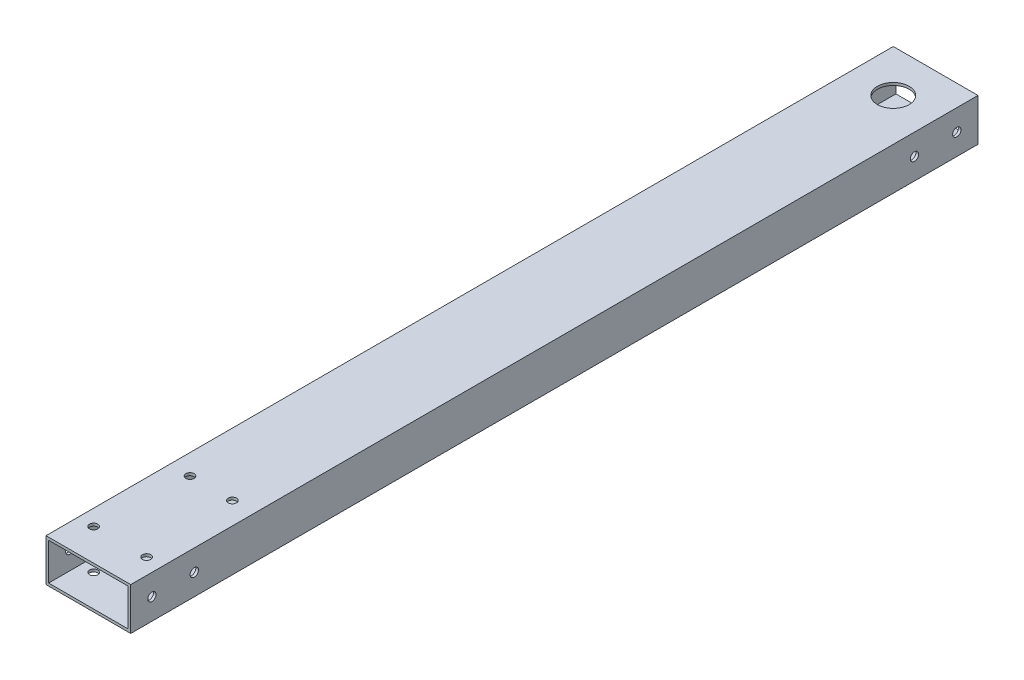
from build123d import *

# Parameters (mm, degrees)
BOSS_EXTRUDE1_DEPTH      = 254.000001
BOSS_EXTRUDE1_DEPTH_BACK = 254.000001
SKETCH3_W                = 50.8
SKETCH3_H                = 25.4
SKETCH3_W_2              = 47.625
SKETCH3_H_2              = 22.225
F_10_CLEARANCE_HOLE1_D   = 4.9784
F_10_CLEARANCE_HOLE2_D   = 4.9784
SKETCH11_R               = 9.525
CUT_EXTRUDE1_DEPTH       = 257.527426425


with BuildPart() as part:
    # Sketch3 → Boss-Extrude1 (new, two sides: drawn at the far end of the back side and taken through both)
    with BuildSketch(Plane.XY.offset(-BOSS_EXTRUDE1_DEPTH_BACK)):
        Rectangle(SKETCH3_W, SKETCH3_H)
        Rectangle(SKETCH3_W_2, SKETCH3_H_2, mode=Mode.SUBTRACT)
    extrude(amount=BOSS_EXTRUDE1_DEPTH + BOSS_EXTRUDE1_DEPTH_BACK)

    # #10 Clearance Hole1 (through all)
    with Locations(Plane(origin=(25.4, 0, 0), x_dir=(0, 0, -1), z_dir=(1, 0, 0))):
        with Locations((-241.300000508, 0), (-215.900000508, 0), (215.899999492, 0), (241.299999492, 0)):
            Hole(F_10_CLEARANCE_HOLE1_D / 2)

    # #10 Clearance Hole2 (through all)
    with Locations(Plane(origin=(0, 12.7, 0), x_dir=(1, 0, 0), z_dir=(0, 1, 0))):
        with Locations((-13.207999909, -179.867533038), (12.192000091, -179.867533038), (-15.875, -234.950000508), (15.875, -234.950000508)):
            Hole(F_10_CLEARANCE_HOLE2_D / 2)

    # Sketch11 → Cut-Extrude1 (cut, through all)
    with BuildSketch(Plane(origin=(0, 12.7, 0), x_dir=(1, 0, 0), z_dir=(0, 1, 0))):
        with Locations(Location((0, 228.600000508, 0), (0, 0, 180))):
            Circle(SKETCH11_R)
    extrude(amount=-CUT_EXTRUDE1_DEPTH, mode=Mode.SUBTRACT)


solid = part.part
